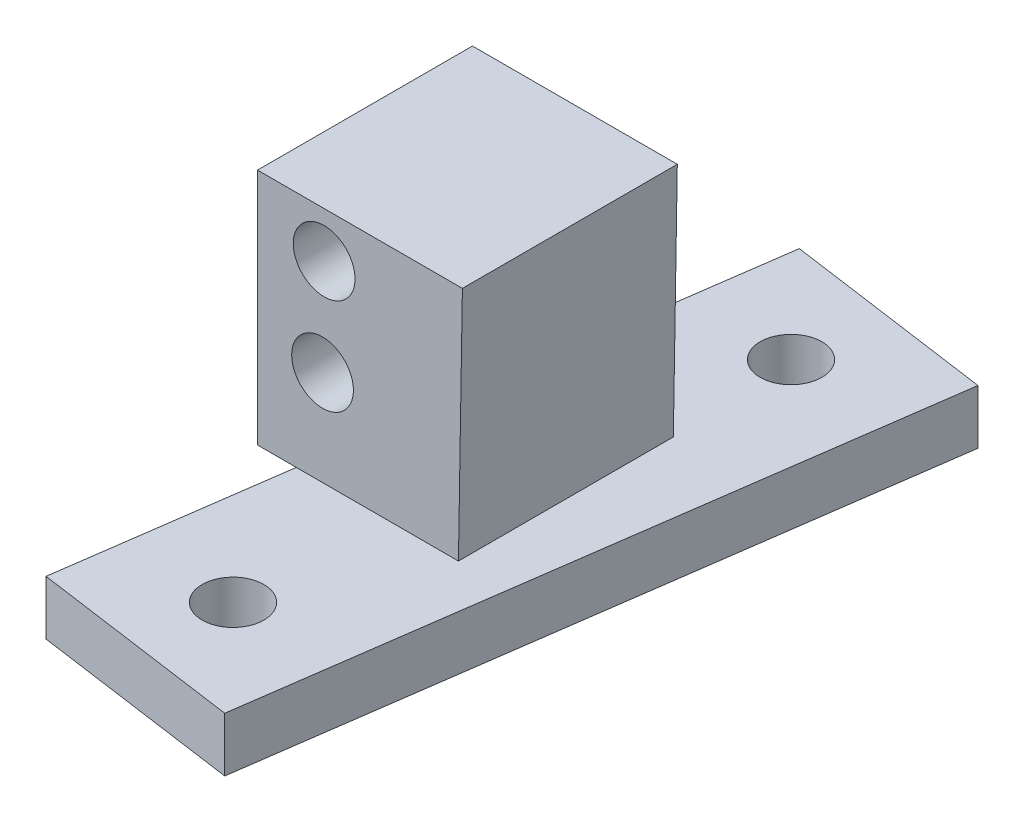
from build123d import *

# Parameters (mm, degrees)
SKETCH1_R           = 3.175
BOSS_EXTRUDE1_DEPTH = 22.098
SKETCH2_R           = 3.175
BOSS_EXTRUDE2_DEPTH = 5.588


with BuildPart() as part:
    # Sketch1 → Boss-Extrude1 (new body)
    with BuildSketch(Plane.XY):
        Polygon((430.481837091, 135.188251435), (451.546293611, 135.188251435), (451.139125986, 110.702070678), (430.481837091, 110.702070678), align=None)
        with Locations(Location((437.331098026, 130.5, 0), (0, 0, 180))):
            Circle(SKETCH1_R, mode=Mode.SUBTRACT)
        with Locations(Location((437.164813366, 120.5, 0), (0, 0, 180))):
            Circle(SKETCH1_R, mode=Mode.SUBTRACT)
    extrude(amount=BOSS_EXTRUDE1_DEPTH)

    # Sketch2 → Boss-Extrude2 (add)
    with BuildSketch(Plane(origin=(0, 110.702070678, 0), x_dir=(1, 0, 0), z_dir=(0, 1, 0))):
        Polygon((431.295573302, -44.662968175), (440.840064565, 23.249615979), (462.21995217, 20.24486873), (452.675460906, -47.667715425), align=None)
        with Locations(Location((443.222765971, -37.361858669, 0), (0, 0, 270))):
            Circle(SKETCH2_R, mode=Mode.SUBTRACT)
        with Locations(Location((450.2927595, 12.943759223, 0), (0, 0, 270))):
            Circle(SKETCH2_R, mode=Mode.SUBTRACT)
    extrude(amount=-BOSS_EXTRUDE2_DEPTH)


solid = part.part
